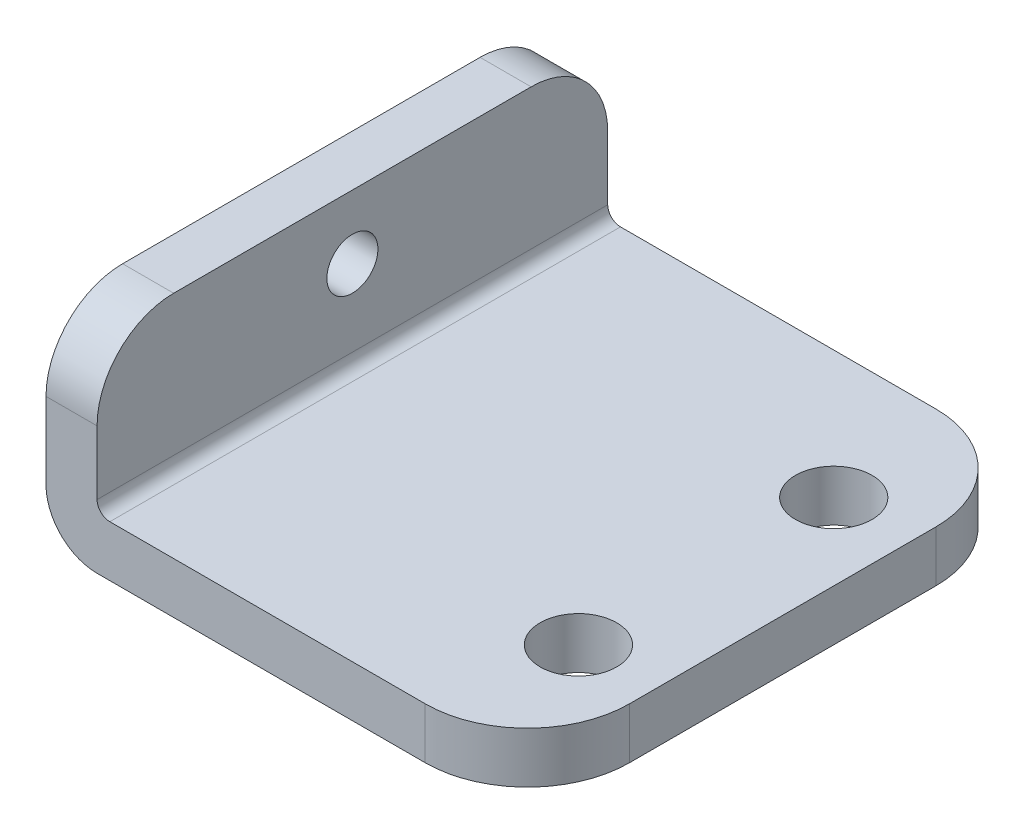
from build123d import *

# Parameters (mm, degrees)
SKETCH1_W           = 16.852791878
SKETCH1_H           = 20
BOSS_EXTRUDE1_DEPTH = 2
FILLET1_R           = 4
SKETCH2_W           = 20
SKETCH2_H           = 8
SKETCH2_R           = 1
BOSS_EXTRUDE2_DEPTH = 2
FILLET2_R           = 3
FILLET3_R           = 3
FILLET4_R           = 2
FILLET5_R           = 0.5
SKETCH3_R           = 1.5
CUT_EXTRUDE1_DEPTH  = 16.643200832


with BuildPart() as part:
    # Sketch1 → Boss-Extrude1 (new body)
    with BuildSketch(Plane(origin=(0, 0, 0), x_dir=(1, 0, 0), z_dir=(0, 1, 0))):
        Rectangle(SKETCH1_W, SKETCH1_H)
    extrude(amount=BOSS_EXTRUDE1_DEPTH)

    # Fillet1
    fillet1_edges = [part.edges().sort_by_distance(p)[0] for p in [
        (8.426395939, 1, 10),
        (8.426395939, 1, -10),
    ]]
    fillet(fillet1_edges, radius=FILLET1_R)

    # Sketch2 → Boss-Extrude2 (add)
    with BuildSketch(Plane.ZY.offset(8.426395939)):
        with Locations((0, 4)):
            Rectangle(SKETCH2_W, SKETCH2_H)
        with Locations((0, 5.5)):
            Circle(SKETCH2_R, mode=Mode.SUBTRACT)
    extrude(amount=BOSS_EXTRUDE2_DEPTH)

    # Fillet2
    fillet2_edges = [part.edges().sort_by_distance(p)[0] for p in [
        (-9.426395939, 8, 10),
    ]]
    fillet(fillet2_edges, radius=FILLET2_R)

    # Fillet3
    fillet3_edges = [part.edges().sort_by_distance(p)[0] for p in [
        (-9.426395939, 8, -10),
    ]]
    fillet(fillet3_edges, radius=FILLET3_R)

    # Fillet4
    fillet4_edges = [part.edges().sort_by_distance(p)[0] for p in [
        (-10.426395939, 0, 0),
    ]]
    fillet(fillet4_edges, radius=FILLET4_R)

    # Fillet5
    fillet5_edges = [part.edges().sort_by_distance(p)[0] for p in [
        (-8.426395939, 2, 0),
    ]]
    fillet(fillet5_edges, radius=FILLET5_R)

    # Sketch3 → Cut-Extrude1 (cut, through all)
    with BuildSketch(Plane(origin=(0, 2, 0), x_dir=(1, 0, 0), z_dir=(0, 1, 0))):
        with Locations(Location((5.426395939, 5, 0), (0, 0, 270))):
            Circle(SKETCH3_R)
        with Locations(Location((5.426395939, -5, 0), (0, 0, 270))):
            Circle(SKETCH3_R)
    extrude(amount=-CUT_EXTRUDE1_DEPTH, mode=Mode.SUBTRACT)


solid = part.part
